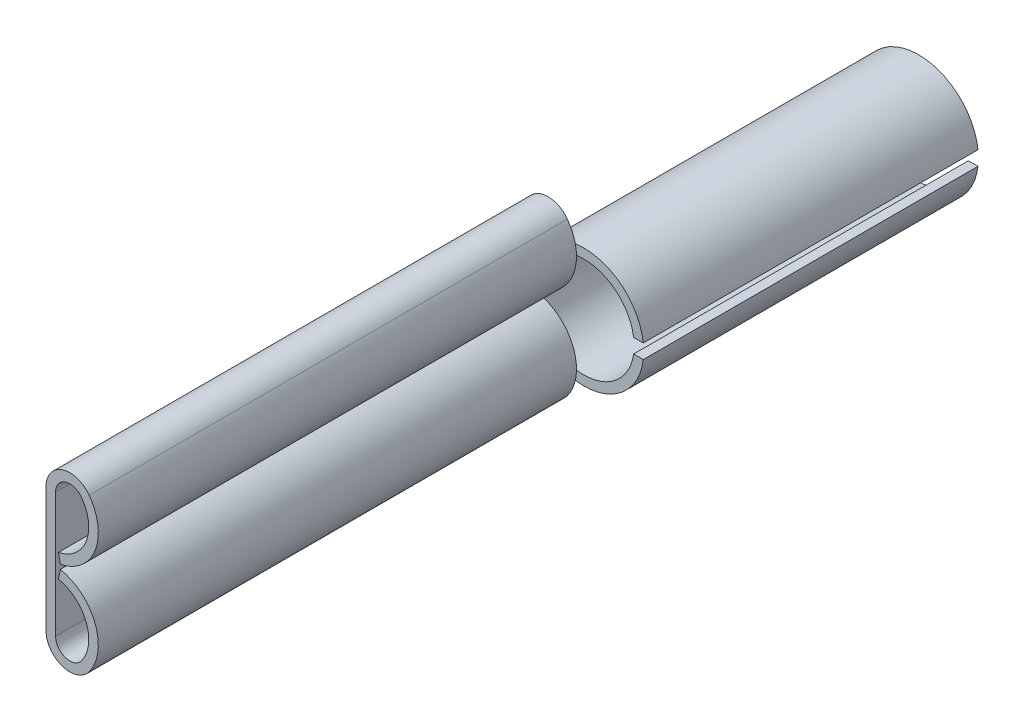
from build123d import *

# Parameters (mm, degrees)
EXTRUDE_1_DEPTH = 10
EXTRUDE_2_DEPTH = 7


with BuildPart() as part:
    # Эскиз1 → Вытянуть1 (new body)
    with BuildSketch(Plane.XY):
        with BuildLine():
            Line((0.2, 0.695621493), (0.2, 3.304378507))
            ThreePointArc((0.2, 3.304378507), (0.407098908, 3.589631705), (0.74246258, 3.481047398))
            ThreePointArc((0.74246258, 3.481047398), (0.840114832, 2.729978951), (0.260484004, 2.242467025))
            Line((0.260484004, 2.242467025), (0.3, 2.046409671))
            ThreePointArc((0.3, 2.046409671), (1.026500083, 2.657449384), (0.9041043, 3.598826659))
            ThreePointArc((0.9041043, 3.598826659), (0.345164846, 3.779800504), (0, 3.304378507))
            Line((0, 3.304378507), (0, 0.695621493))
            ThreePointArc((0, 0.695621493), (0.345164846, 0.220199496), (0.9041043, 0.401173341))
            ThreePointArc((0.9041043, 0.401173341), (1.026500083, 1.342550616), (0.3, 1.953590329))
            Line((0.3, 1.953590329), (0.260484004, 1.757532975))
            ThreePointArc((0.260484004, 1.757532975), (0.840114832, 1.270021049), (0.74246258, 0.518952602))
            ThreePointArc((0.74246258, 0.518952602), (0.407098908, 0.410368295), (0.2, 0.695621493))
        make_face()
    extrude(amount=EXTRUDE_1_DEPTH)

    # Эскиз2 → Вытянуть2 (add)
    with BuildSketch(Plane(origin=(0, 0, 0), x_dir=(-1, 0, 0), z_dir=(0, 0, -1))):
        with BuildLine():
            Line((-2.490967365, 1.85), (-2.289230485, 1.85))
            ThreePointArc((-2.289230485, 1.85), (-0.2, 2), (-2.289230485, 2.15))
            Line((-2.289230485, 2.15), (-2.490967365, 2.15))
            ThreePointArc((-2.490967365, 2.15), (0, 2), (-2.490967365, 1.85))
        make_face()
    extrude(amount=EXTRUDE_2_DEPTH)


solid = part.part
